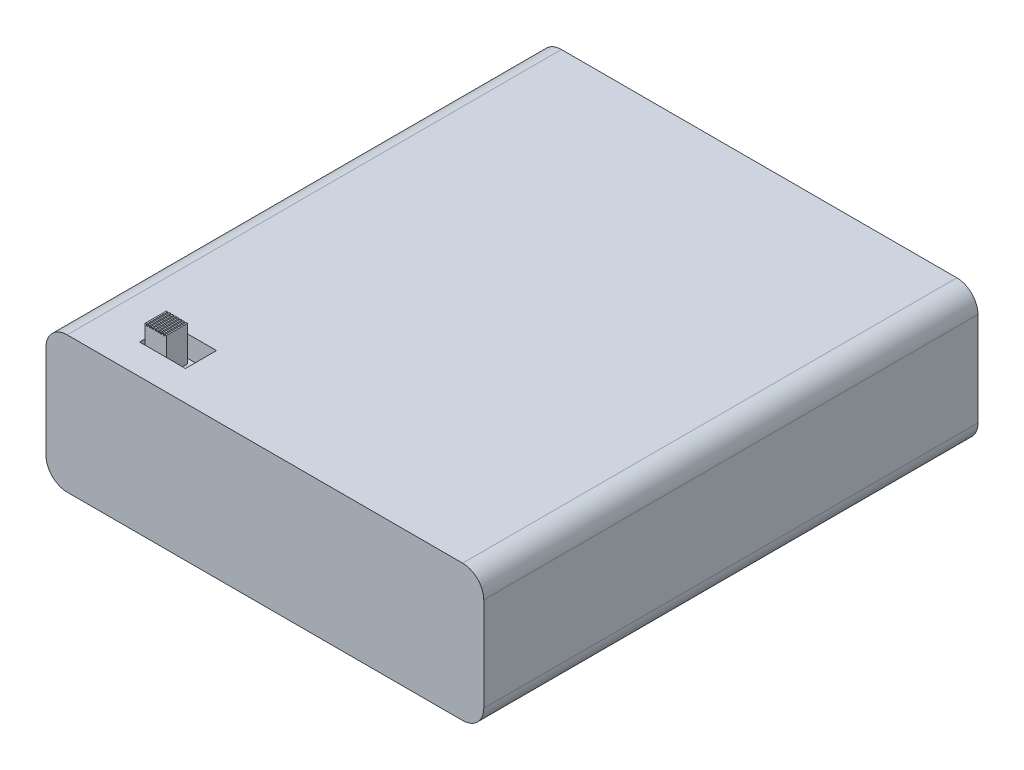
from build123d import *

# Parameters (mm, degrees)
BOSS_EXTRUDE1_DEPTH = 35
SKETCH2_W           = 6.5
SKETCH2_H           = 4.4
CUT_EXTRUDE1_DEPTH  = 3
SKETCH3_W           = 3
SKETCH3_H           = 3
BOSS_EXTRUDE2_DEPTH = 5
SKETCH4_W           = 0.2
SKETCH4_H           = 0.2
CUT_EXTRUDE2_DEPTH  = 73.994691588


with BuildPart() as part:
    # Sketch1 → Boss-Extrude1 (new, symmetric)
    with BuildSketch(Plane.XY):
        with BuildLine():
            Line((-28, 9.65), (28, 9.65))
            ThreePointArc((28, 9.65), (30.121320344, 8.771320344), (31, 6.65))
            Line((31, 6.65), (31, -6.65))
            ThreePointArc((31, -6.65), (30.121320344, -8.771320344), (28, -9.65))
            Line((28, -9.65), (-28, -9.65))
            ThreePointArc((-28, -9.65), (-30.121320344, -8.771320344), (-31, -6.65))
            Line((-31, -6.65), (-31, 6.65))
            ThreePointArc((-31, 6.65), (-30.121320344, 8.771320344), (-28, 9.65))
        make_face()
    extrude(amount=BOSS_EXTRUDE1_DEPTH, both=True)

    # Sketch2 → Cut-Extrude1 (cut)
    with BuildSketch(Plane(origin=(0, 9.65, 0), x_dir=(1, 0, 0), z_dir=(0, 1, 0))):
        with Locations((-18.75, -28.55)):
            Rectangle(SKETCH2_W, SKETCH2_H)
    extrude(amount=-CUT_EXTRUDE1_DEPTH, mode=Mode.SUBTRACT)

    # Sketch3 → Boss-Extrude2 (add)
    with BuildSketch(Plane(origin=(0, 6.65, 0), x_dir=(1, 0, 0), z_dir=(0, 1, 0))):
        with Locations((-20.4, -28.55)):
            Rectangle(SKETCH3_W, SKETCH3_H)
    extrude(amount=BOSS_EXTRUDE2_DEPTH)

    # Sketch4 → Cut-Extrude2 (cut, through all)
    with BuildSketch(Plane.XY.offset(30.05)):
        with Locations((-21.602270094, 11.55)):
            Rectangle(SKETCH4_W, SKETCH4_H)
        with Locations((-21.202270094, 11.55)):
            Rectangle(SKETCH4_W, SKETCH4_H)
        with Locations((-20.802270094, 11.55)):
            Rectangle(SKETCH4_W, SKETCH4_H)
        with Locations((-20.402270094, 11.55)):
            Rectangle(SKETCH4_W, SKETCH4_H)
        with Locations((-20.002270094, 11.55)):
            Rectangle(SKETCH4_W, SKETCH4_H)
        with Locations((-19.602270094, 11.55)):
            Rectangle(SKETCH4_W, SKETCH4_H)
        with Locations((-19.202270094, 11.55)):
            Rectangle(SKETCH4_W, SKETCH4_H)
    extrude(amount=-CUT_EXTRUDE2_DEPTH, mode=Mode.SUBTRACT)


solid = part.part
